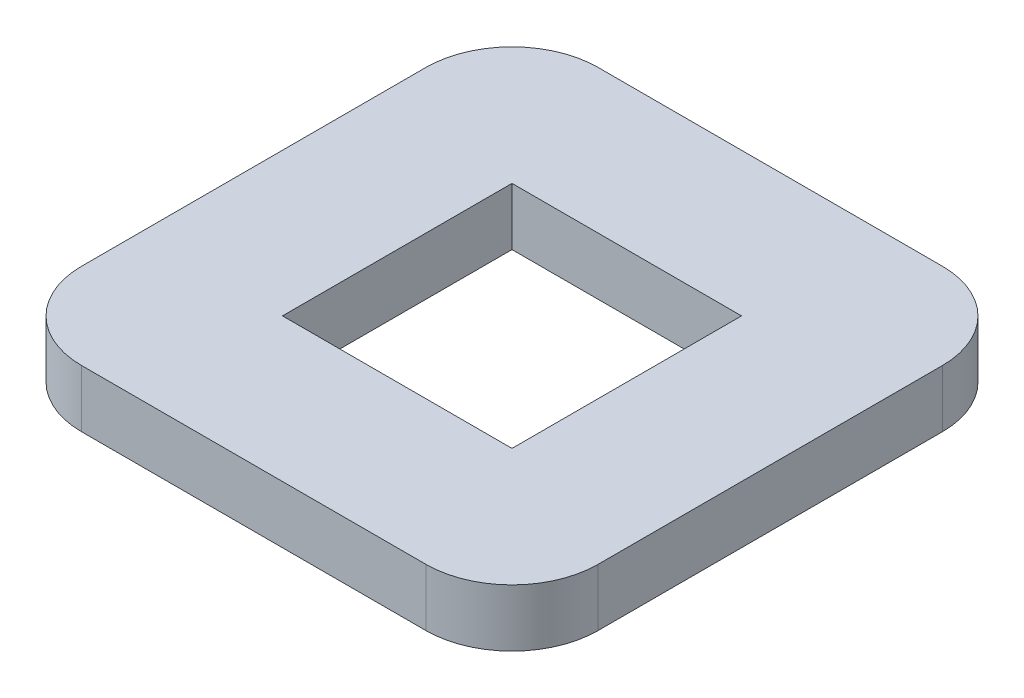
from build123d import *

# Parameters (mm, degrees)
SKETCH1_W           = 8
SKETCH1_H           = 8
BOSS_EXTRUDE1_DEPTH = 2


with BuildPart() as part:
    # Sketch1 → Boss-Extrude1 (new body)
    with BuildSketch(Plane(origin=(0, 0, 0), x_dir=(1, 0, 0), z_dir=(0, 1, 0))):
        with BuildLine():
            Line((-6, 9), (6, 9))
            ThreePointArc((6, 9), (8.121320344, 8.121320344), (9, 6))
            Line((9, 6), (9, -6))
            ThreePointArc((9, -6), (8.121320344, -8.121320344), (6, -9))
            Line((6, -9), (-6, -9))
            ThreePointArc((-6, -9), (-8.121320344, -8.121320344), (-9, -6))
            Line((-9, -6), (-9, 6))
            ThreePointArc((-9, 6), (-8.121320344, 8.121320344), (-6, 9))
        make_face()
        Rectangle(SKETCH1_W, SKETCH1_H, mode=Mode.SUBTRACT)
    extrude(amount=BOSS_EXTRUDE1_DEPTH)


solid = part.part
